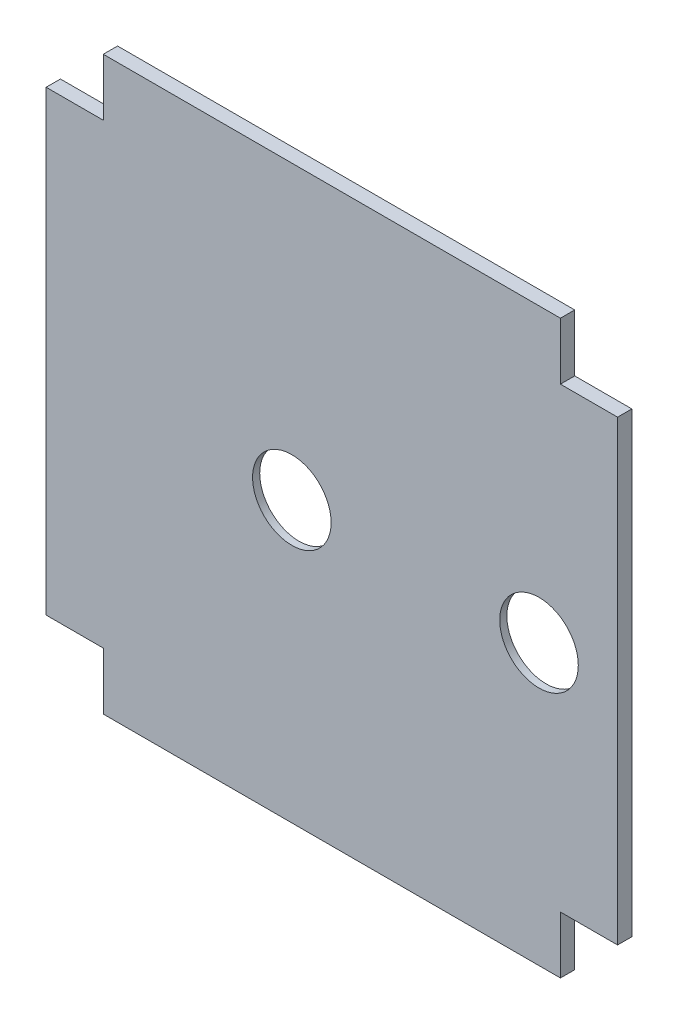
from build123d import *

# Parameters (mm, degrees)
SKETCH1_W           = 100
SKETCH1_H           = 100
BOSS_EXTRUDE1_DEPTH = 2.5
SKETCH4_R           = 6.875
CUT_EXTRUDE2_DEPTH  = 142.443451598
SKETCH5_R           = 8.75
CUT_EXTRUDE3_DEPTH  = 1.25
SKETCH6_W           = 10
SKETCH6_H           = 10
CUT_EXTRUDE4_DEPTH  = 142.443451598


with BuildPart() as part:
    # Sketch1 → Boss-Extrude1 (new body)
    with BuildSketch(Plane.XY):
        with Locations((50, 50)):
            Rectangle(SKETCH1_W, SKETCH1_H)
    extrude(amount=BOSS_EXTRUDE1_DEPTH)

    # Sketch4 → Cut-Extrude2 (cut, through all)
    with BuildSketch(Plane.XY.offset(2.5)):
        with Locations((86.250042234, 48.943031999)):
            Circle(SKETCH4_R)
        with Locations((43.000042234, 48.943031999)):
            Circle(SKETCH4_R)
    extrude(amount=-CUT_EXTRUDE2_DEPTH, mode=Mode.SUBTRACT)

    # Sketch5 → Cut-Extrude3 (cut)
    with BuildSketch(Plane(origin=(0, 0, 0), x_dir=(-1, 0, 0), z_dir=(0, 0, -1))):
        with Locations((-86.250042234, 48.943031999)):
            Circle(SKETCH5_R)
        with Locations((-43.000042234, 48.943031999)):
            Circle(SKETCH5_R)
    extrude(amount=-CUT_EXTRUDE3_DEPTH, mode=Mode.SUBTRACT)

    # Sketch6 → Cut-Extrude4 (cut, through all)
    with BuildSketch(Plane(origin=(0, 0, 0), x_dir=(-1, 0, 0), z_dir=(0, 0, -1))):
        with Locations((-95, 95)):
            Rectangle(SKETCH6_W, SKETCH6_H)
        with Locations((-95, 5)):
            Rectangle(SKETCH6_W, SKETCH6_H)
        with Locations((-5, 95)):
            Rectangle(SKETCH6_W, SKETCH6_H)
        with Locations((-5, 5)):
            Rectangle(SKETCH6_W, SKETCH6_H)
    extrude(amount=-CUT_EXTRUDE4_DEPTH, mode=Mode.SUBTRACT)


solid = part.part
